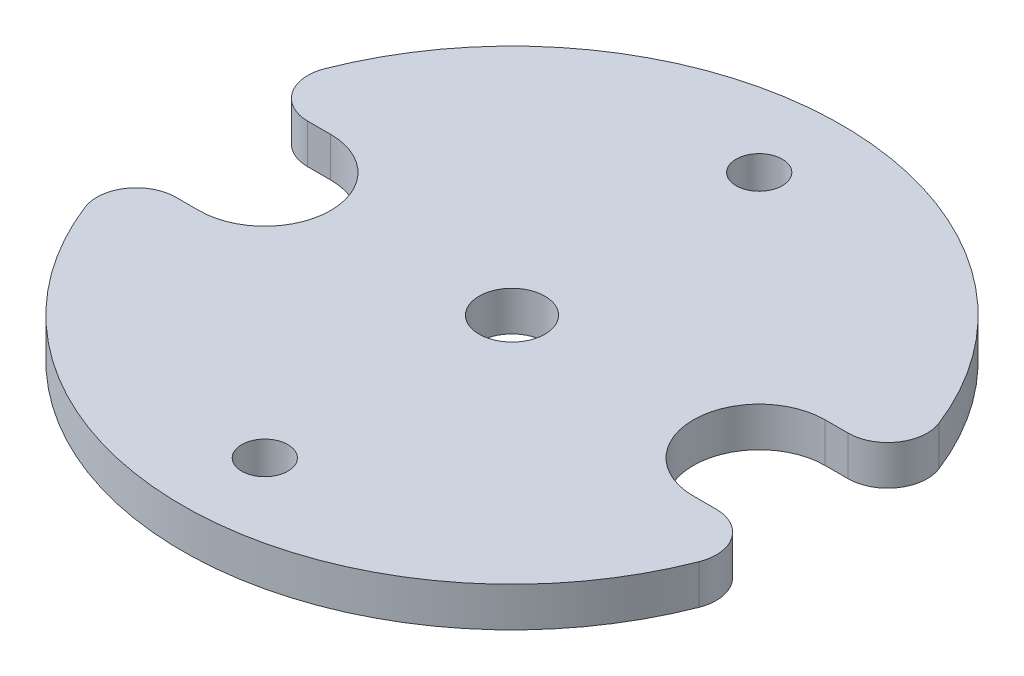
from build123d import *

# Parameters (mm, degrees)
SKETCH1_R           = 1.778
SKETCH1_R_2         = 2.54
BOSS_EXTRUDE1_DEPTH = 3.048


with BuildPart() as part:
    # Sketch1 → Boss-Extrude1 (new body)
    with BuildSketch(Plane(origin=(0, 0, 0), x_dir=(1, 0, 0), z_dir=(0, 1, 0))):
        with BuildLine():
            Line((-28.837830229, 5.581683581), (-30.609634186, 5.581683581))
            ThreePointArc((-30.609634186, 5.581683581), (-33.126437353, 6.910379705), (-33.448971089, 9.738047217))
            ThreePointArc((-33.448971089, 9.738047217), (-9.787830229, 25.901683581), (13.87331063, 9.738047217))
            ThreePointArc((13.87331063, 9.738047217), (13.550776894, 6.910379705), (11.033973727, 5.581683581))
            Line((11.033973727, 5.581683581), (9.262169771, 5.581683581))
            ThreePointArc((9.262169771, 5.581683581), (4.182169771, 0.501683581), (9.262169771, -4.578316419))
            Line((9.262169771, -4.578316419), (11.033973727, -4.578316419))
            ThreePointArc((11.033973727, -4.578316419), (13.550776894, -5.907012543), (13.87331063, -8.734680055))
            ThreePointArc((13.87331063, -8.734680055), (-9.787830229, -24.898316419), (-33.448971089, -8.734680055))
            ThreePointArc((-33.448971089, -8.734680055), (-33.126437353, -5.907012543), (-30.609634186, -4.578316419))
            Line((-30.609634186, -4.578316419), (-28.837830229, -4.578316419))
            ThreePointArc((-28.837830229, -4.578316419), (-23.757830229, 0.501683581), (-28.837830229, 5.581683581))
        make_face()
        with Locations(Location((-9.787830229, 19.551683581, 0), (0, 0, 90))):
            Circle(SKETCH1_R, mode=Mode.SUBTRACT)
        with Locations(Location((-9.787830229, -18.548316419, 0), (0, 0, 90))):
            Circle(SKETCH1_R, mode=Mode.SUBTRACT)
        with Locations(Location((-9.787830229, 0.501683581, 0), (0, 0, 90))):
            Circle(SKETCH1_R_2, mode=Mode.SUBTRACT)
    extrude(amount=BOSS_EXTRUDE1_DEPTH)


solid = part.part
